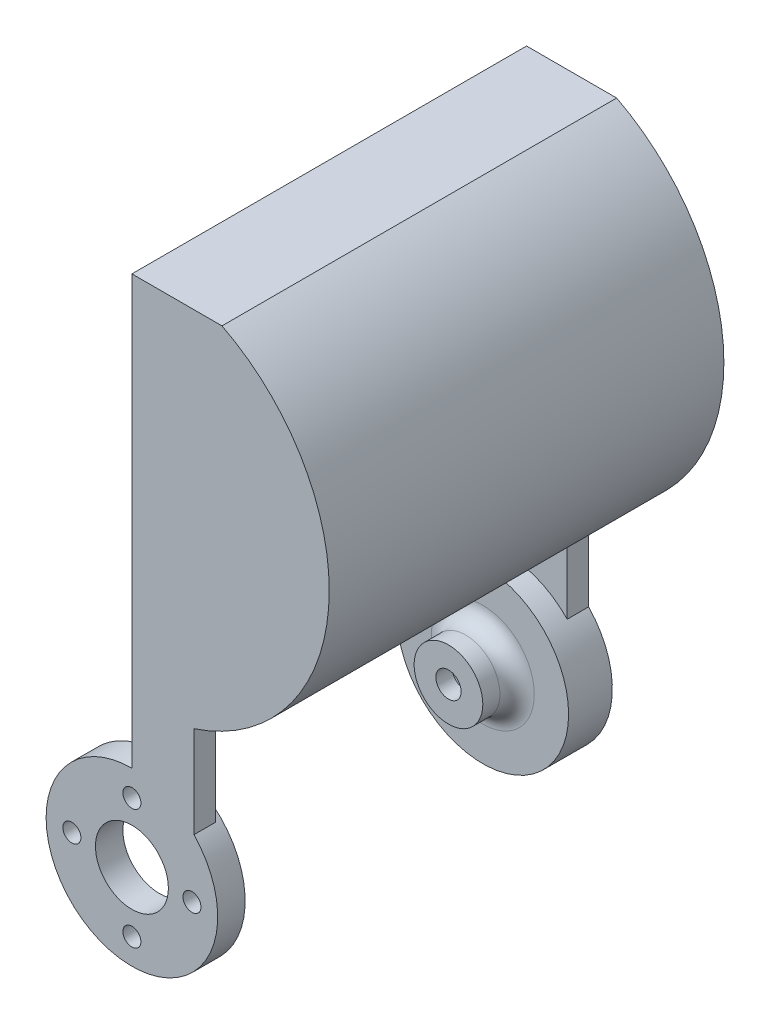
from build123d import *

# Parameters (mm, degrees)
BOSS_EXTRUDE1_DEPTH = 23
BOSS_EXTRUDE3_DEPTH = 2
SKETCH4_W           = 20
SKETCH4_H           = 41
CUT_EXTRUDE1_DEPTH  = 18.2
SKETCH5_R           = 10
SKETCH5_R_2         = 4.25
BOSS_EXTRUDE4_DEPTH = 0.7
CUT_EXTRUDE2_REACH  = 80.949
SKETCH6_R           = 1.05
SKETCH6_R_2         = 4.25
BOSS_EXTRUDE5_START = 6.1
SKETCH7_R           = 10
BOSS_EXTRUDE5_DEPTH = 6.1
SKETCH11_R          = 4
BOSS_EXTRUDE6_DEPTH = 0.5
SKETCH10_R          = 3
CUT_EXTRUDE4_DEPTH  = 7.2
CUT_EXTRUDE3_REACH  = 80.949
SKETCH9_R           = 1.475
SKETCH12_R          = 5
CUT_EXTRUDE5_DEPTH  = 4
SKETCH13_R          = 10
SKETCH13_R_2        = 4
CUT_EXTRUDE6_DEPTH  = 3.5
FILLET2_R           = 2


with BuildPart() as part:
    # Sketch1 → Boss-Extrude1 (new, symmetric)
    with BuildSketch(Plane.XY):
        with BuildLine():
            Line((0, 59.9), (16.889174661, 50.149030463))
            ThreePointArc((16.889174661, 50.149030463), (17.524957173, 29.799404984), (0, 19.43661807))
            Line((0, 19.43661807), (0, 10))
            ThreePointArc((0, 10), (-3.934485272, -9.193466465), (7.234311682, 6.903965128))
            Line((7.234311682, 6.903965128), (7.234311682, 17.603965128))
            ThreePointArc((7.234311682, 17.603965128), (22.931748607, 37.666051544), (10.5, 59.9))
            Line((10.5, 59.9), (0, 59.9))
        make_face()
    extrude(amount=BOSS_EXTRUDE1_DEPTH, both=True)

    # Sketch3 → Boss-Extrude3 (add)
    with BuildSketch(Plane.XY.offset(23)):
        with BuildLine():
            Line((0, 59.9), (0, 19.43661807))
            ThreePointArc((0, 19.43661807), (17.524957173, 29.799404984), (16.889174661, 50.149030463))
            Line((16.889174661, 50.149030463), (0, 59.9))
        make_face()
    boss_extrude3 = extrude(amount=-BOSS_EXTRUDE3_DEPTH)

    # Mirror1: Boss-Extrude3 across plane
    add(boss_extrude3.mirror(Plane.XY))

    # Sketch4 → Cut-Extrude1 (cut, symmetric)
    with BuildSketch(Plane(origin=(0, 0, 0), x_dir=(1, 0, 0), z_dir=(0, 1, 0))):
        Rectangle(SKETCH4_W, SKETCH4_H)
    extrude(amount=CUT_EXTRUDE1_DEPTH, both=True, mode=Mode.SUBTRACT)

    # Sketch5 → Boss-Extrude4 (add)
    with BuildSketch(Plane(origin=(0, 0, 20.5), x_dir=(-1, 0, 0), z_dir=(0, 0, -1))):
        Circle(SKETCH5_R)
        Circle(SKETCH5_R_2, mode=Mode.SUBTRACT)
    extrude(amount=BOSS_EXTRUDE4_DEPTH)

    # Sketch6 → Cut-Extrude2 (cut, up to next)
    with BuildSketch(Plane.XY.offset(23), mode=Mode.PRIVATE) as cut_extrude2_sk1:
        with Locations((0, 7)):
            Circle(SKETCH6_R)
    cut_extrude2_tool1 = extrude(cut_extrude2_sk1.sketch, amount=-CUT_EXTRUDE2_REACH, mode=Mode.PRIVATE) & part.part
    # Sketch6 → Cut-Extrude2 (cut, up to next)
    with BuildSketch(Plane.XY.offset(23), mode=Mode.PRIVATE) as cut_extrude2_sk2:
        with Locations((7, 0)):
            Circle(SKETCH6_R)
    cut_extrude2_tool2 = extrude(cut_extrude2_sk2.sketch, amount=-CUT_EXTRUDE2_REACH, mode=Mode.PRIVATE) & part.part
    # Sketch6 → Cut-Extrude2 (cut, up to next)
    with BuildSketch(Plane.XY.offset(23), mode=Mode.PRIVATE) as cut_extrude2_sk3:
        with Locations((0, -7)):
            Circle(SKETCH6_R)
    cut_extrude2_tool3 = extrude(cut_extrude2_sk3.sketch, amount=-CUT_EXTRUDE2_REACH, mode=Mode.PRIVATE) & part.part
    # Sketch6 → Cut-Extrude2 (cut, up to next)
    with BuildSketch(Plane.XY.offset(23), mode=Mode.PRIVATE) as cut_extrude2_sk4:
        with Locations((-7, 0)):
            Circle(SKETCH6_R)
    cut_extrude2_tool4 = extrude(cut_extrude2_sk4.sketch, amount=-CUT_EXTRUDE2_REACH, mode=Mode.PRIVATE) & part.part
    # Sketch6 → Cut-Extrude2 (cut, up to next)
    with BuildSketch(Plane.XY.offset(23), mode=Mode.PRIVATE) as cut_extrude2_sk5:
        Circle(SKETCH6_R_2)
    cut_extrude2_tool5 = extrude(cut_extrude2_sk5.sketch, amount=-CUT_EXTRUDE2_REACH, mode=Mode.PRIVATE) & part.part
    add(cut_extrude2_tool1.solids().sort_by_distance((0, 7, 23))[0], mode=Mode.SUBTRACT)
    add(cut_extrude2_tool2.solids().sort_by_distance((7, 0, 23))[0], mode=Mode.SUBTRACT)
    add(cut_extrude2_tool3.solids().sort_by_distance((0, -7, 23))[0], mode=Mode.SUBTRACT)
    add(cut_extrude2_tool4.solids().sort_by_distance((-7, 0, 23))[0], mode=Mode.SUBTRACT)
    add(cut_extrude2_tool5.solids().sort_by_distance((0, 0, 23))[0], mode=Mode.SUBTRACT)

    # Sketch7 → Boss-Extrude5 (add)
    with BuildSketch(Plane.XY.offset(-20.5).offset(BOSS_EXTRUDE5_START)):
        with Locations(Location((0, 0, 0), (0, 0, 90))):
            Circle(SKETCH7_R)
    extrude(amount=-BOSS_EXTRUDE5_DEPTH)

    # Sketch11 → Boss-Extrude6 (add)
    with BuildSketch(Plane.XY.offset(-14.4)):
        Circle(SKETCH11_R)
    extrude(amount=BOSS_EXTRUDE6_DEPTH)

    # Sketch10 → Cut-Extrude4 (cut)
    with BuildSketch(Plane(origin=(0, 0, -23), x_dir=(-1, 0, 0), z_dir=(0, 0, -1))):
        Circle(SKETCH10_R)
    extrude(amount=-CUT_EXTRUDE4_DEPTH, mode=Mode.SUBTRACT)

    # Sketch9 → Cut-Extrude3 (cut, up to next)
    with BuildSketch(Plane(origin=(0, 0, -23), x_dir=(-1, 0, 0), z_dir=(0, 0, -1)), mode=Mode.PRIVATE) as cut_extrude3_sk1:
        Circle(SKETCH9_R)
    cut_extrude3_tool1 = extrude(cut_extrude3_sk1.sketch, amount=-CUT_EXTRUDE3_REACH, mode=Mode.PRIVATE) & part.part
    add(cut_extrude3_tool1.solids().sort_by_distance((0, 0, -23))[0], mode=Mode.SUBTRACT)

    # Sketch12 → Cut-Extrude5 (cut)
    with BuildSketch(Plane(origin=(0, 0, -23), x_dir=(-1, 0, 0), z_dir=(0, 0, -1))):
        Circle(SKETCH12_R)
    extrude(amount=-CUT_EXTRUDE5_DEPTH, mode=Mode.SUBTRACT)

    # Sketch13 → Cut-Extrude6 (cut)
    with BuildSketch(Plane.XY.offset(-14.4)):
        with Locations(Location((0, 0, 0), (0, 0, 90))):
            Circle(SKETCH13_R)
        Circle(SKETCH13_R_2, mode=Mode.SUBTRACT)
    extrude(amount=-CUT_EXTRUDE6_DEPTH, mode=Mode.SUBTRACT)

    # Fillet2
    fillet2_edges = [part.edges().sort_by_distance(p)[0] for p in [
        (-4, 0, -17.9),
    ]]
    fillet(fillet2_edges, radius=FILLET2_R)


solid = part.part
